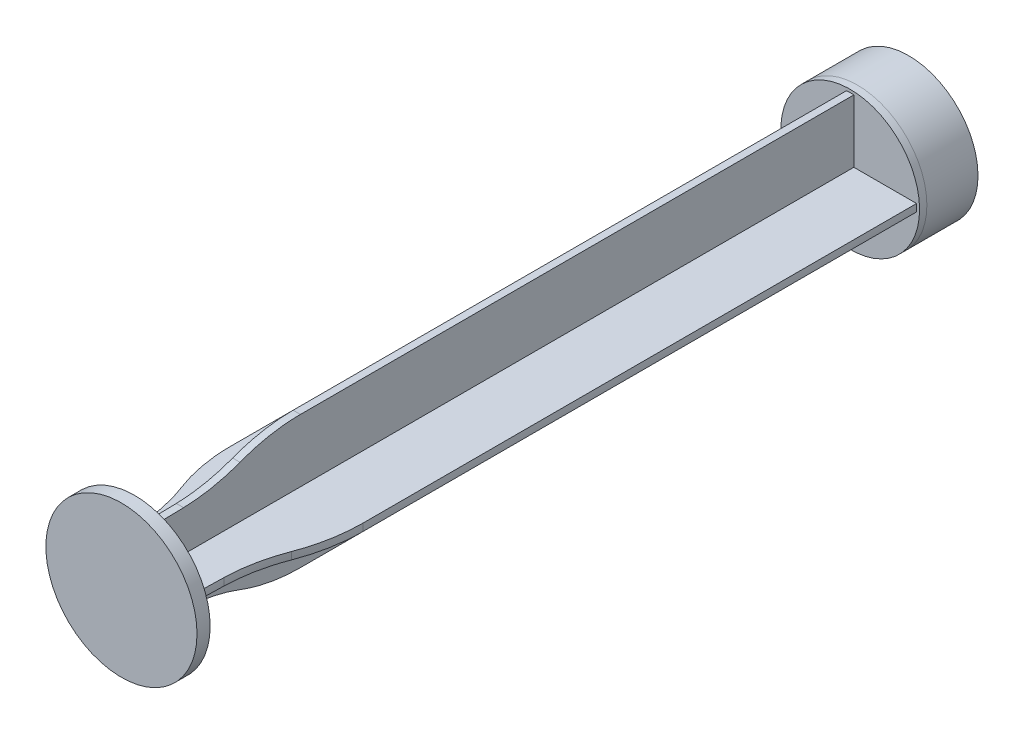
from build123d import *

# Parameters (mm, degrees)
SKETCH1_R           = 9.5
BOSS_EXTRUDE1_DEPTH = 1
BOSS_EXTRUDE2_DEPTH = 98
SKETCH3_R           = 10.35
BOSS_EXTRUDE3_DEPTH = 1.8


with BuildPart() as part:
    # Sketch1 → Boss-Extrude1 (new body)
    with BuildSketch(Plane.XY):
        Circle(SKETCH1_R)
    extrude(amount=BOSS_EXTRUDE1_DEPTH)

    # Sketch2 → Boss-Extrude2 (add)
    with BuildSketch(Plane.XY.offset(1)):
        Polygon((-0.5, 9.1), (0.5, 9.1), (0.5, 0.5), (9.1, 0.5), (9.1, -0.5), (0.5, -0.5), (0.5, -9.1), (-0.5, -9.1), (-0.5, -0.5), (-9.1, -0.5), (-9.1, 0.5), (-0.5, 0.5), align=None)
    extrude(amount=BOSS_EXTRUDE2_DEPTH)

    # Sketch3 → Boss-Extrude3 (add)
    with BuildSketch(Plane.XY.offset(99)):
        Circle(SKETCH3_R)
    extrude(amount=BOSS_EXTRUDE3_DEPTH)

    # Sketch4 → Cut-Revolve1 (revolve, cut)
    with BuildSketch(Plane(origin=(0, 0, 0), x_dir=(0, 0, -1), z_dir=(1, 0, 0))):
        with BuildLine():
            Line((-99, 5.9), (-99, 9.1))
            Line((-99, 9.1), (-99, 10.35))
            Line((-99, 10.35), (-1, 10.35))
            Line((-1, 10.35), (-1, 9.1))
            Line((-1, 9.1), (-76.8, 9.1))
            ThreePointArc((-76.8, 9.1), (-81.01018846, 8.714701704), (-85.080505008, 7.571607291))
            ThreePointArc((-85.080505008, 7.571607291), (-88.875263794, 6.481099639), (-92.8, 6.05))
            Line((-92.8, 6.05), (-99, 5.9))
        make_face()
    revolve(axis=Axis((0, 0, 99), (0, 0, -1)), mode=Mode.SUBTRACT)


with BuildPart() as body_2:
    # Sketch6 → Revolve1 (revolve)
    with BuildSketch(Plane(origin=(0, 0, 0), x_dir=(0, 0, -1), z_dir=(1, 0, 0)), mode=Mode.PRIVATE) as revolve1_sk:
        Polygon((0, 0), (0, 9.5), (7, 9.5), (9.034889329, 0), align=None)
    revolve(revolve1_sk.sketch.rotate(Axis((0, 0, 0), (0, 0, -1)), 90), axis=Axis((0, 0, 0), (0, 0, -1)))


solid = Compound([part.part, body_2.part])
